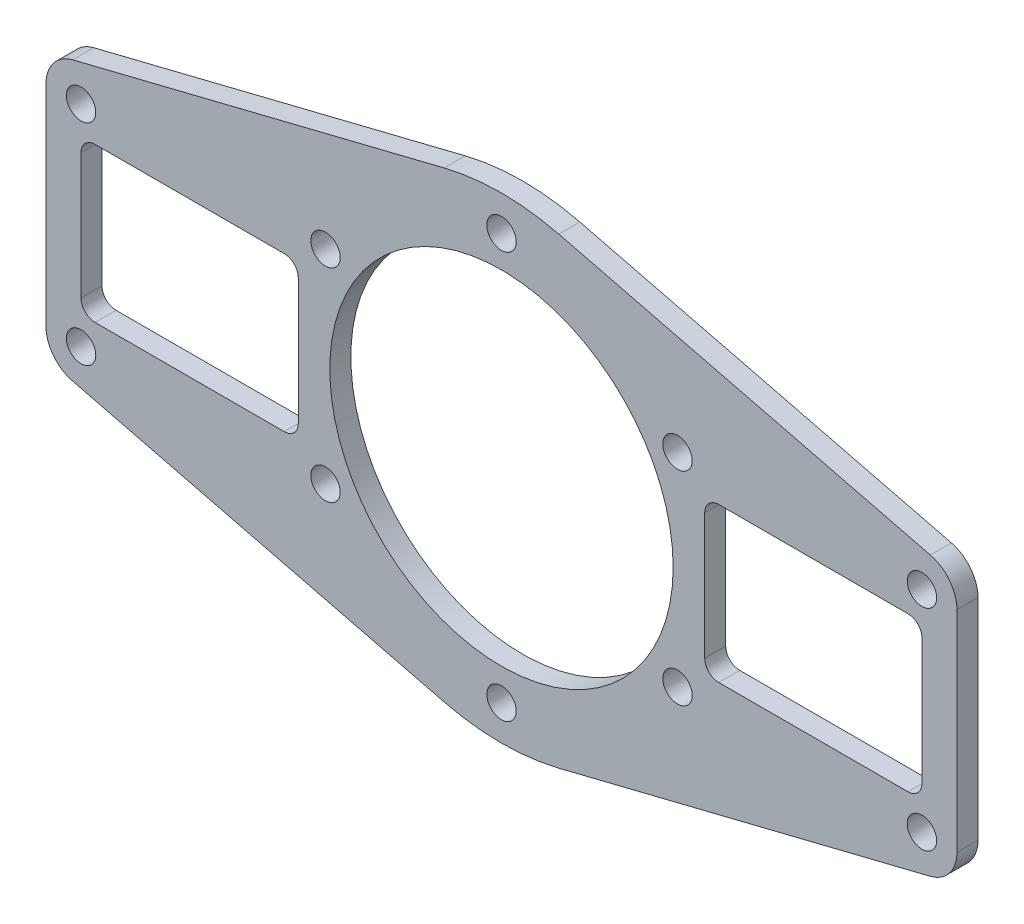
from build123d import *

# Parameters (mm, degrees)
SKETCH_1_R          = 24.5
SKETCH_1_R_2        = 2.1
EXTRUDE_1_DEPTH     = 3
CUT_EXTRUDE_1_DEPTH = 10


with BuildPart() as part:
    # 草图1 → 凸台-拉伸1 (new body)
    with BuildSketch(Plane.XY):
        with BuildLine():
            Line((-65, 15), (-65, -15))
            ThreePointArc((-65, -15), (-63.938087017, -18.080823047), (-61.203411742, -19.853019697))
            Line((-61.203411742, -19.853019697), (-8.183199849, -33.000533939))
            ThreePointArc((-8.183199849, -33.000533939), (0, -34), (8.183199849, -33.000533939))
            Line((8.183199849, -33.000533939), (61.203411742, -19.853019697))
            ThreePointArc((61.203411742, -19.853019697), (63.938087017, -18.080823047), (65, -15))
            Line((65, -15), (65, 15))
            ThreePointArc((65, 15), (63.938087017, 18.080823047), (61.203411742, 19.853019697))
            Line((61.203411742, 19.853019697), (8.183199849, 33.000533939))
            ThreePointArc((8.183199849, 33.000533939), (0, 34), (-8.183199849, 33.000533939))
            Line((-8.183199849, 33.000533939), (-61.203411742, 19.853019697))
            ThreePointArc((-61.203411742, 19.853019697), (-63.938087017, 18.080823047), (-65, 15))
        make_face()
        Circle(SKETCH_1_R, mode=Mode.SUBTRACT)
        with Locations((0, 29)):
            Circle(SKETCH_1_R_2, mode=Mode.SUBTRACT)
        with Locations((25.11473671, 14.5)):
            Circle(SKETCH_1_R_2, mode=Mode.SUBTRACT)
        with Locations((25.11473671, -14.5)):
            Circle(SKETCH_1_R_2, mode=Mode.SUBTRACT)
        with Locations((0, -29)):
            Circle(SKETCH_1_R_2, mode=Mode.SUBTRACT)
        with Locations((-25.11473671, -14.5)):
            Circle(SKETCH_1_R_2, mode=Mode.SUBTRACT)
        with Locations((-25.11473671, 14.5)):
            Circle(SKETCH_1_R_2, mode=Mode.SUBTRACT)
        with Locations((-60, 15)):
            Circle(SKETCH_1_R_2, mode=Mode.SUBTRACT)
        with Locations((-60, -15)):
            Circle(SKETCH_1_R_2, mode=Mode.SUBTRACT)
        with Locations((60, -15)):
            Circle(SKETCH_1_R_2, mode=Mode.SUBTRACT)
        with Locations((60, 15)):
            Circle(SKETCH_1_R_2, mode=Mode.SUBTRACT)
    extrude(amount=EXTRUDE_1_DEPTH)

    # 草图2 → 切除-拉伸1 (cut)
    with BuildSketch(Plane.XY.offset(3)):
        with BuildLine():
            Line((-58, 11), (-31, 11))
            ThreePointArc((-31, 11), (-29.585786438, 10.414213562), (-29, 9))
            Line((-29, 9), (-29, -9))
            ThreePointArc((-29, -9), (-29.585786438, -10.414213562), (-31, -11))
            Line((-31, -11), (-58, -11))
            ThreePointArc((-58, -11), (-59.414213562, -10.414213562), (-60, -9))
            Line((-60, -9), (-60, 9))
            ThreePointArc((-60, 9), (-59.414213562, 10.414213562), (-58, 11))
        make_face()
        with BuildLine():
            Line((31, 11), (58, 11))
            ThreePointArc((58, 11), (59.414213562, 10.414213562), (60, 9))
            Line((60, 9), (60, -9))
            ThreePointArc((60, -9), (59.414213562, -10.414213562), (58, -11))
            Line((58, -11), (31, -11))
            ThreePointArc((31, -11), (29.585786438, -10.414213562), (29, -9))
            Line((29, -9), (29, 9))
            ThreePointArc((29, 9), (29.585786438, 10.414213562), (31, 11))
        make_face()
    extrude(amount=-CUT_EXTRUDE_1_DEPTH, mode=Mode.SUBTRACT)


solid = part.part
